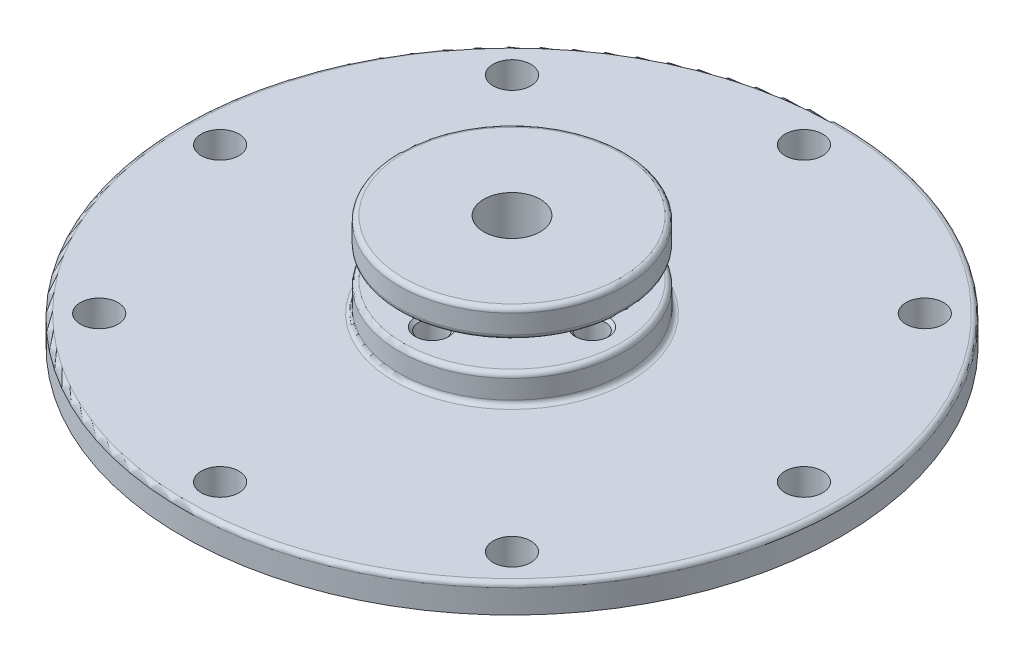
from build123d import *

# Parameters (mm, degrees)
SKETCH2_R                         = 2
CUT_EXTRUDE1_DEPTH                = 10
M3_5X0_6_TAPPED_HOLE1_D           = 2.9
M3_5X0_6_TAPPED_HOLE1_DEPTH       = 7.128752102
M3_5X0_6_TAPPED_HOLE1_CSINK_D     = 3.55
M3_5X0_6_TAPPED_HOLE1_CSINK_ANGLE = 90
M3_5X0_6_TAPPED_HOLE1_TIP         = 0.871247898
SKETCH11_W                        = 3
SKETCH11_H                        = 3


with BuildPart() as part:
    # Sketch1 → Revolve1 (revolve)
    with BuildSketch(Plane.XY):
        with BuildLine():
            Line((-4.5, 0), (-4.5, 4))
            Line((-4.5, 4), (-6, 4))
            Line((-6, 4), (-6, 10))
            Line((-6, 10), (-11.5, 10))
            ThreePointArc((-11.5, 10), (-11.853553391, 9.853553391), (-12, 9.5))
            Line((-12, 9.5), (-12, 7.5))
            ThreePointArc((-12, 7.5), (-12.146446609, 7.146446609), (-12.5, 7))
            Line((-12.5, 7), (-34.5, 7))
            ThreePointArc((-34.5, 7), (-34.853553391, 6.853553391), (-35, 6.5))
            Line((-35, 6.5), (-35, 4))
            Line((-35, 4), (-22.5, 4))
            Line((-22.5, 4), (-22.5, 0))
            Line((-22.5, 0), (-4.5, 0))
        make_face()
    revolve(axis=Axis((0, 16.306688785, 0), (0, -1, 0)))

    # Sketch2 → Cut-Extrude1 (cut)
    with BuildSketch(Plane(origin=(0, 10, 0), x_dir=(1, 0, 0), z_dir=(0, 1, 0))):
        with Locations(Location((0, 31, 0), (0, 0, 180))):
            Circle(SKETCH2_R)
        with Locations(Location((21.920310217, 21.920310217, 0), (0, 0, 180))):
            Circle(SKETCH2_R)
        with Locations(Location((31, 0, 0), (0, 0, 180))):
            Circle(SKETCH2_R)
        with Locations(Location((21.920310217, -21.920310217, 0), (0, 0, 180))):
            Circle(SKETCH2_R)
        with Locations(Location((0, -31, 0), (0, 0, 180))):
            Circle(SKETCH2_R)
        with Locations(Location((-21.920310217, -21.920310217, 0), (0, 0, 180))):
            Circle(SKETCH2_R)
        with Locations(Location((-31, 0, 0), (0, 0, 180))):
            Circle(SKETCH2_R)
        with Locations(Location((-21.920310217, 21.920310217, 0), (0, 0, 180))):
            Circle(SKETCH2_R)
    extrude(amount=-CUT_EXTRUDE1_DEPTH, mode=Mode.SUBTRACT)

    # M3.5x0.6 Tapped Hole1
    with Locations(Plane(origin=(0, 10, 0), x_dir=(1, 0, 0), z_dir=(0, 1, 0))):
        with Locations((0, 8.5), (-8.5, 0), (8.5, 0), (0, -8.5)):
            CounterSinkHole(M3_5X0_6_TAPPED_HOLE1_D / 2, M3_5X0_6_TAPPED_HOLE1_CSINK_D / 2, depth=M3_5X0_6_TAPPED_HOLE1_DEPTH, counter_sink_angle=M3_5X0_6_TAPPED_HOLE1_CSINK_ANGLE)
            with Locations((0, 0, -(M3_5X0_6_TAPPED_HOLE1_DEPTH + M3_5X0_6_TAPPED_HOLE1_TIP / 2))):  # 118° drill point
                Cone(0, M3_5X0_6_TAPPED_HOLE1_D / 2, M3_5X0_6_TAPPED_HOLE1_TIP, mode=Mode.SUBTRACT)


with BuildPart() as body_2:
    # Sketch9 → Revolve2 (revolve)
    with BuildSketch(Plane.XY, mode=Mode.PRIVATE) as revolve2_sk:
        Polygon((-3, 0), (-4.5, 0), (-4.5, 4), (-6, 4), (-6, 6), (-3, 6), align=None)
    revolve(revolve2_sk.sketch.rotate(Axis((0, 11.645875966, 0), (0, -1, 0)), 270), axis=Axis((0, 11.645875966, 0), (0, -1, 0)))


with BuildPart() as body_3:
    # Sketch11 → Revolve3 (revolve)
    with BuildSketch(Plane.XY, mode=Mode.PRIVATE) as revolve3_sk:
        with Locations((-4.5, 7.5)):
            Rectangle(SKETCH11_W, SKETCH11_H)
    revolve(revolve3_sk.sketch.rotate(Axis((0, 11.645875966, 0), (0, 1, 0)), 270), axis=Axis((0, 11.645875966, 0), (0, 1, 0)))


with BuildPart() as body_4:
    # Sketch12 → Revolve4 (revolve)
    with BuildSketch(Plane.XY, mode=Mode.PRIVATE) as revolve4_sk:
        with BuildLine():
            Line((-6, 13), (-11.5, 13))
            ThreePointArc((-11.5, 13), (-11.853553391, 13.146446609), (-12, 13.5))
            Line((-12, 13.5), (-12, 15.5))
            ThreePointArc((-12, 15.5), (-11.853553391, 15.853553391), (-11.5, 16))
            Line((-11.5, 16), (-3, 16))
            Line((-3, 16), (-3, 9))
            Line((-3, 9), (-6, 9))
            Line((-6, 9), (-6, 13))
        make_face()
    revolve(revolve4_sk.sketch.rotate(Axis((0, 11.645875966, 0), (0, 1, 0)), 270), axis=Axis((0, 11.645875966, 0), (0, 1, 0)))


solid = Compound([part.part, body_2.part, body_3.part, body_4.part])
